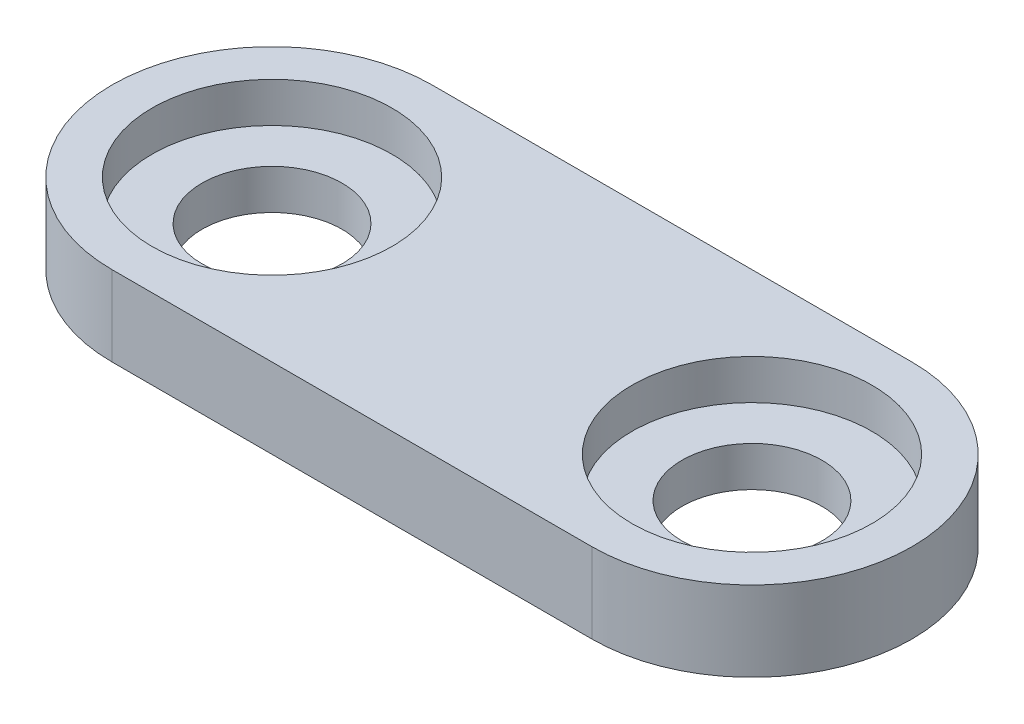
from build123d import *

# Parameters (mm, degrees)
SKETCH1_R           = 1.75
BOSS_EXTRUDE1_DEPTH = 2
SKETCH3_R           = 3
CUT_EXTRUDE1_DEPTH  = 1


with BuildPart() as part:
    # Sketch1 → Boss-Extrude1 (new body)
    with BuildSketch(Plane(origin=(0, 0, 0), x_dir=(1, 0, 0), z_dir=(0, 1, 0))):
        with BuildLine():
            Line((-6, 4), (6, 4))
            ThreePointArc((6, 4), (10, 0), (6, -4))
            Line((6, -4), (-6, -4))
            ThreePointArc((-6, -4), (-10, 0), (-6, 4))
        make_face()
        with Locations(Location((-6, 0, 0), (0, 0, 270))):
            Circle(SKETCH1_R, mode=Mode.SUBTRACT)
        with Locations(Location((6, 0, 0), (0, 0, 270))):
            Circle(SKETCH1_R, mode=Mode.SUBTRACT)
    extrude(amount=BOSS_EXTRUDE1_DEPTH)

    # Sketch3 → Cut-Extrude1 (cut)
    with BuildSketch(Plane(origin=(0, 2, 0), x_dir=(1, 0, 0), z_dir=(0, 1, 0))):
        with Locations(Location((-6, 0, 0), (0, 0, 270))):
            Circle(SKETCH3_R)
        with Locations(Location((6, 0, 0), (0, 0, 270))):
            Circle(SKETCH3_R)
    extrude(amount=-CUT_EXTRUDE1_DEPTH, mode=Mode.SUBTRACT)


solid = part.part
